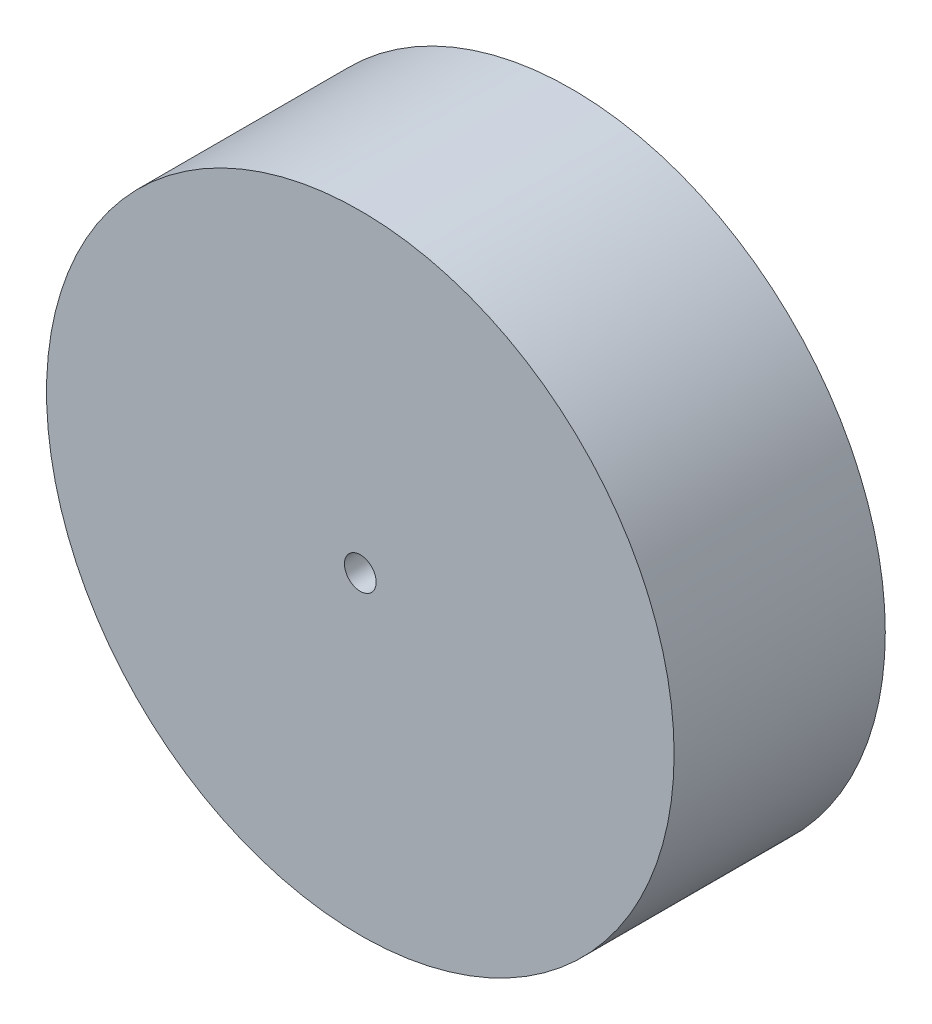
from build123d import *

# Parameters (mm, degrees)
SKETCH1_R           = 14.859
SKETCH1_R_2         = 0.75
BOSS_EXTRUDE1_DEPTH = 10


with BuildPart() as part:
    # Sketch1 → Boss-Extrude1 (new body)
    with BuildSketch(Plane.XY):
        Circle(SKETCH1_R)
        Circle(SKETCH1_R_2, mode=Mode.SUBTRACT)
    extrude(amount=BOSS_EXTRUDE1_DEPTH)


solid = part.part
